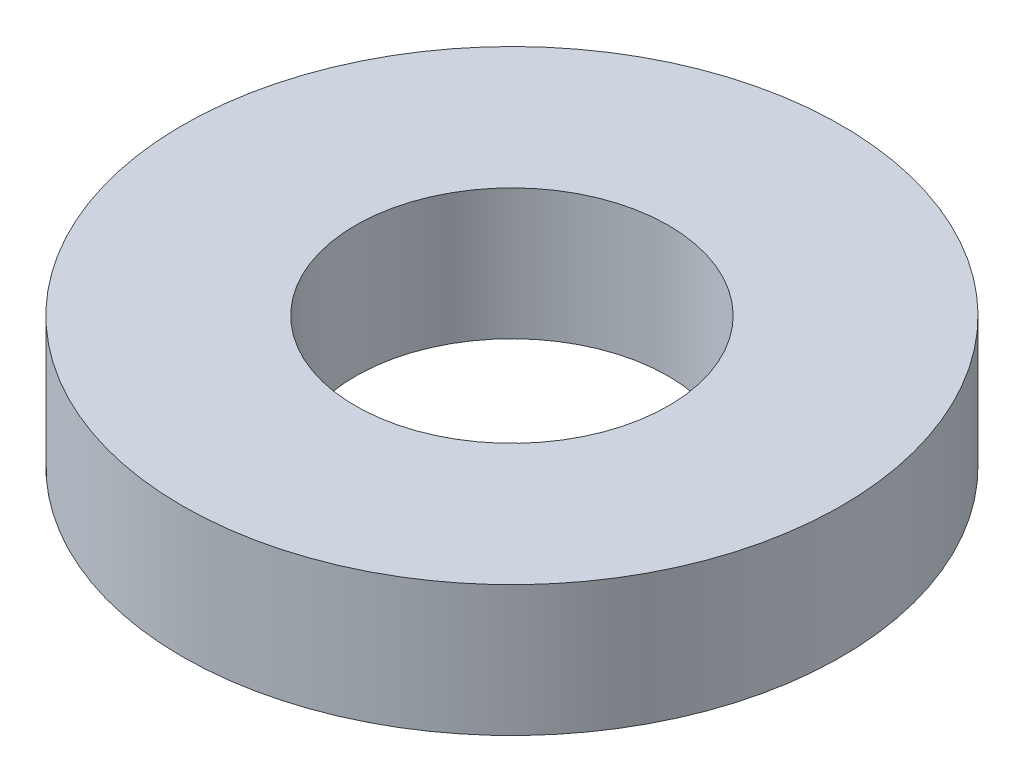
from build123d import *

# Parameters (mm, degrees)
SKETCH1_R           = 12.36
BOSS_EXTRUDE1_DEPTH = 4.9
SKETCH2_R           = 5.8674
CUT_EXTRUDE1_DEPTH  = 19.153490023


with BuildPart() as part:
    # Sketch1 → Boss-Extrude1 (new body)
    with BuildSketch(Plane(origin=(0, 0, 0), x_dir=(1, 0, 0), z_dir=(0, 1, 0))):
        with Locations(Location((0, 0, 0), (0, 0, 270))):
            Circle(SKETCH1_R)
    extrude(amount=BOSS_EXTRUDE1_DEPTH)

    # Sketch2 → Cut-Extrude1 (cut, through all)
    with BuildSketch(Plane(origin=(0, 0, 0), x_dir=(-1, 0, 0), z_dir=(0, -1, 0))):
        with Locations(Location((0, 0, 0), (0, 0, 90))):
            Circle(SKETCH2_R)
    extrude(amount=-CUT_EXTRUDE1_DEPTH, mode=Mode.SUBTRACT)


solid = part.part
